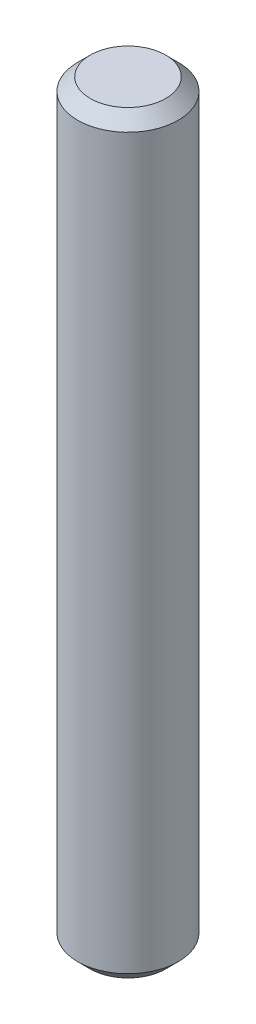
from build123d import *

# Parameters (mm, degrees)
SKETCH1_R           = 2
BOSS_EXTRUDE1_DEPTH = 30
CHAMFER3_SIZE       = 0.5
CHAMFER4_SIZE       = 0.5


with BuildPart() as part:
    # Sketch1 → Boss-Extrude1 (new body)
    with BuildSketch(Plane(origin=(0, 0, 0), x_dir=(1, 0, 0), z_dir=(0, 1, 0))):
        with Locations(Location((0, 0, 0), (0, 0, 270))):
            Circle(SKETCH1_R)
    extrude(amount=BOSS_EXTRUDE1_DEPTH)

    # Chamfer3
    chamfer3_edges = [part.edges().sort_by_distance(p)[0] for p in [
        (0, 0, -2),
    ]]
    chamfer(chamfer3_edges, length=CHAMFER3_SIZE)

    # Chamfer4
    chamfer4_edges = [part.edges().sort_by_distance(p)[0] for p in [
        (0, 30, -2),
    ]]
    chamfer(chamfer4_edges, length=CHAMFER4_SIZE)


solid = part.part
